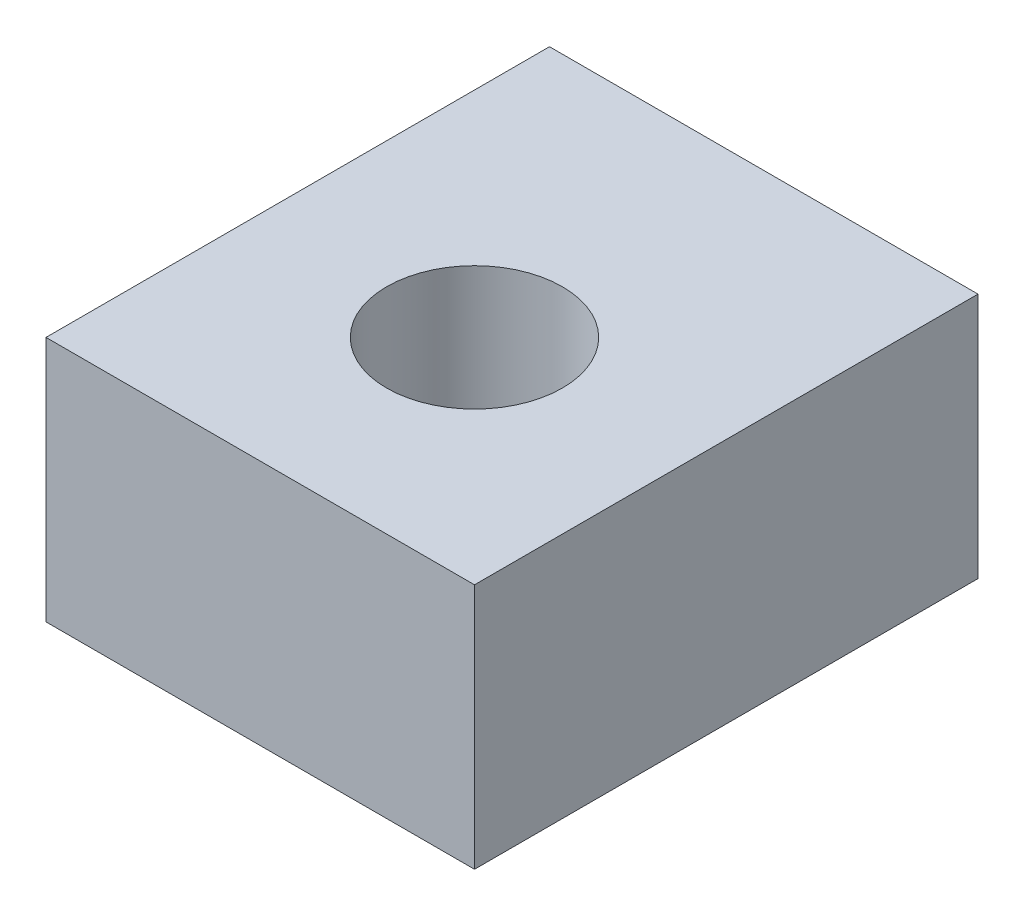
from build123d import *

# Parameters (mm, degrees)
SKETCH1_W           = 20
SKETCH1_H           = 23.5
SKETCH1_R           = 4.1
BOSS_EXTRUDE1_DEPTH = 11.5


with BuildPart() as part:
    # Sketch1 → Boss-Extrude1 (new body)
    with BuildSketch(Plane(origin=(0, 0, 0), x_dir=(1, 0, 0), z_dir=(0, 1, 0))):
        Rectangle(SKETCH1_W, SKETCH1_H)
        with Locations(Location((0, -1.75, 0), (0, 0, 270))):
            Circle(SKETCH1_R, mode=Mode.SUBTRACT)
    extrude(amount=BOSS_EXTRUDE1_DEPTH)


solid = part.part
